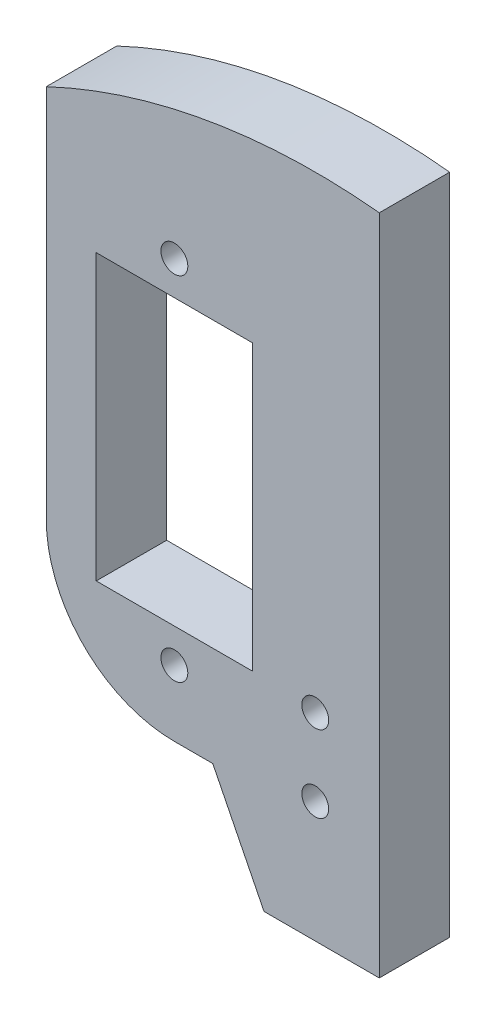
from build123d import *

# Parameters (mm, degrees)
SKETCH_1_R          = 1.05
SKETCH_1_W          = 12.2
SKETCH_1_H          = 22.2
EXTRUDE_1_DEPTH     = 5.5
CUT_EXTRUDE_1_DEPTH = 32.778294479
FILLET_1_R          = 10


with BuildPart() as part:
    # ｽｹｯﾁ1 → ﾎﾞｽ - 押し出し1 (new body)
    with BuildSketch(Plane.XY):
        Polygon((-10, -18.9), (3, -18.9), (7, -26.9), (16, -26.9), (16, 26.1), (-10, 26.1), align=None)
        with Locations((0, -13.75)):
            Circle(SKETCH_1_R, mode=Mode.SUBTRACT)
        with Locations((0, 13.75)):
            Circle(SKETCH_1_R, mode=Mode.SUBTRACT)
        with Locations((11, -17.45)):
            Circle(SKETCH_1_R, mode=Mode.SUBTRACT)
        with Locations((11, -11.45)):
            Circle(SKETCH_1_R, mode=Mode.SUBTRACT)
        Rectangle(SKETCH_1_W, SKETCH_1_H, mode=Mode.SUBTRACT)
    extrude(amount=EXTRUDE_1_DEPTH)

    # ｽｹｯﾁ2 → ｶｯﾄ - 押し出し1 (cut, through all)
    with BuildSketch(Plane.XY.offset(5.5)):
        with BuildLine():
            Line((-10, 20.371887242), (-10, 26.1))
            Line((-10, 26.1), (16, 26.1))
            Line((16, 26.1), (16, 24.844230428))
            ThreePointArc((16, 24.844230428), (2.693348244, 24.390781073), (-10, 20.371887242))
        make_face()
    extrude(amount=-CUT_EXTRUDE_1_DEPTH, mode=Mode.SUBTRACT)

    # ﾌｨﾚｯﾄ1
    fillet_1_edges = [part.edges().sort_by_distance(p)[0] for p in [
        (-10, -18.9, 2.75),
    ]]
    fillet(fillet_1_edges, radius=FILLET_1_R)


solid = part.part
